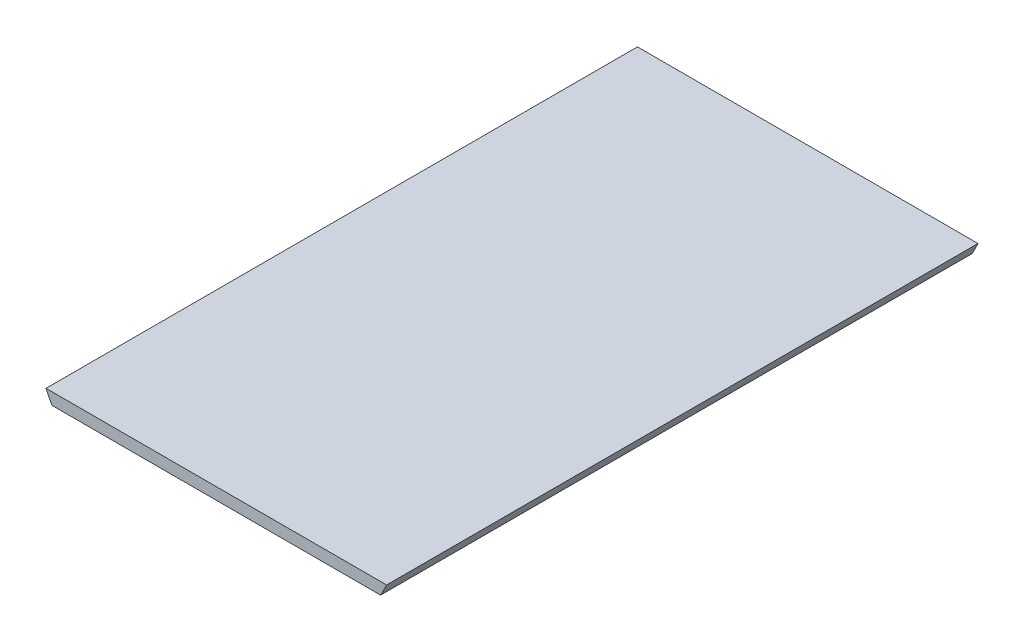
from build123d import *

# Parameters (mm, degrees)
BOSS_EXTRUDE1_DEPTH = 160.02


with BuildPart() as part:
    # Sketch2 → Boss-Extrude1 (new body)
    with BuildSketch(Plane.XY):
        with BuildLine():
            Line((-44.45, -24.593444248), (44.45, -24.593444248))
            ThreePointArc((44.45, -24.593444248), (45.291168316, -23.007609015), (46.075781684, -21.393044248))
            Line((46.075781684, -21.393044248), (-46.075781684, -21.393044248))
            ThreePointArc((-46.075781684, -21.393044248), (-45.291168316, -23.007609015), (-44.45, -24.593444248))
        make_face()
    extrude(amount=BOSS_EXTRUDE1_DEPTH)


solid = part.part
